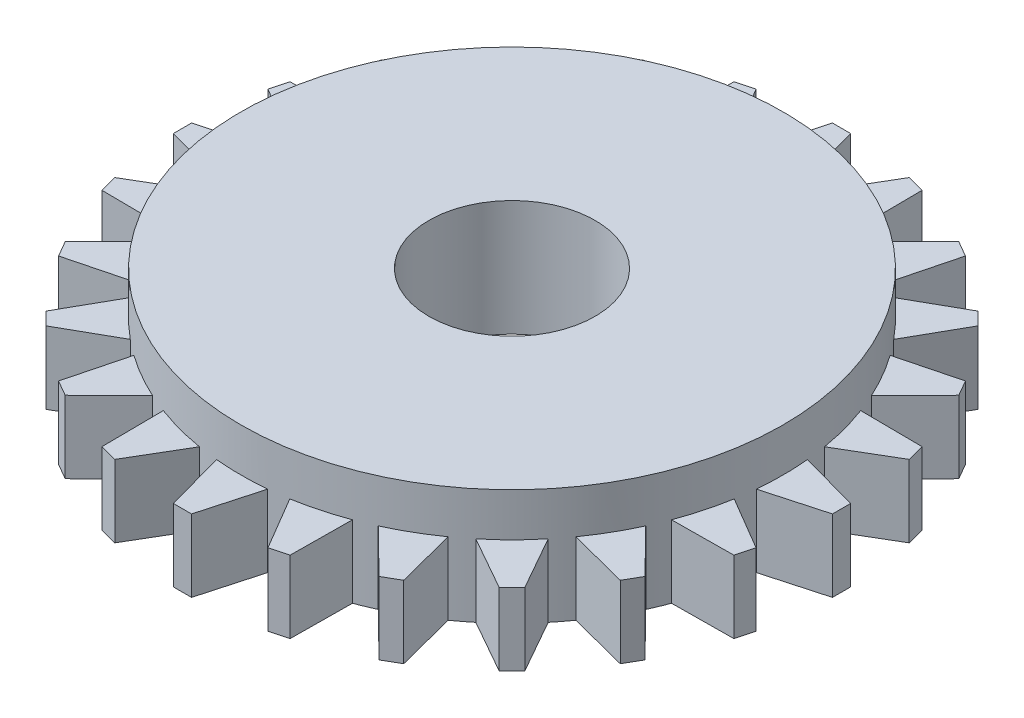
from build123d import *

# Parameters (mm, degrees)
SKETCH1_R           = 7.5
SKETCH1_R_2         = 2.3
BOSS_EXTRUDE1_DEPTH = 3.2
BOSS_EXTRUDE2_DEPTH = 2
CIRPATTERN1_COUNT   = 24


with BuildPart() as part:
    # Sketch1 → Boss-Extrude1 (new body)
    with BuildSketch(Plane(origin=(0, 0, 0), x_dir=(1, 0, 0), z_dir=(0, 1, 0))):
        with Locations(Location((0, 0, 0), (0, 0, 270))):
            Circle(SKETCH1_R)
        with Locations(Location((0, 0, 0), (0, 0, 270))):
            Circle(SKETCH1_R_2, mode=Mode.SUBTRACT)
    extrude(amount=BOSS_EXTRUDE1_DEPTH)

    # Sketch2 → Boss-Extrude2 (add)
    with BuildSketch(Plane.XZ):
        Polygon((9.114493261, 0.25), (9.114493261, -0.25), (7.314493261, -0.75), (7.314493261, 0.75), align=None)
    boss_extrude2 = extrude(amount=-BOSS_EXTRUDE2_DEPTH)

    # CirPattern1: Boss-Extrude2 ×24 about axis
    cirpattern1_axis = Axis((0, 0, 0), (0, 1, 0))
    for i in range(1, CIRPATTERN1_COUNT):
        add(boss_extrude2.rotate(cirpattern1_axis, i * 360 / CIRPATTERN1_COUNT))


solid = part.part
